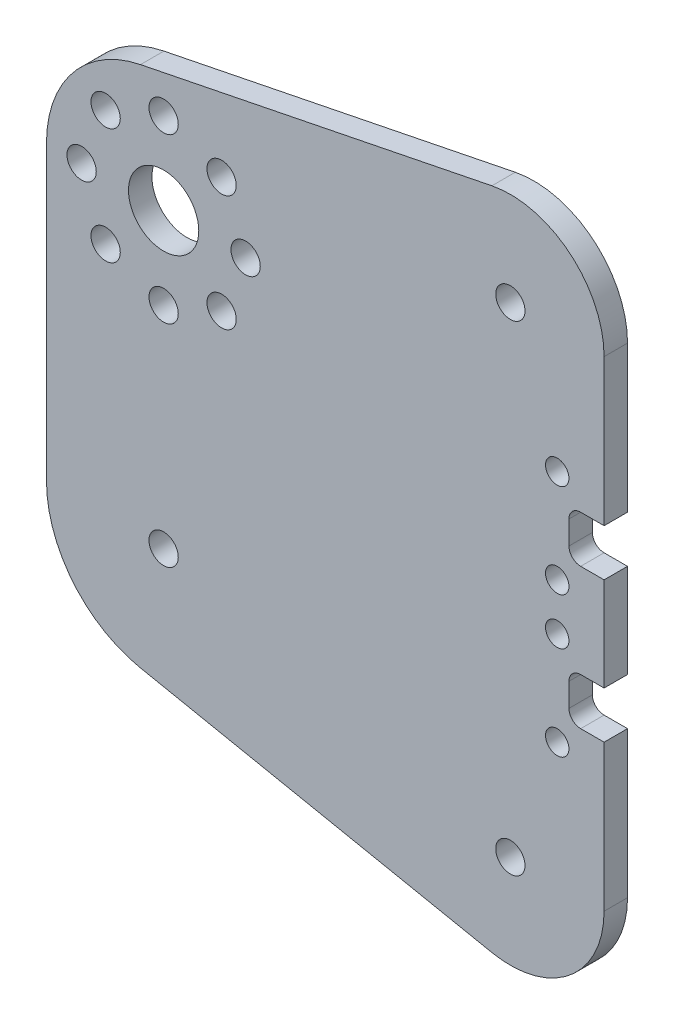
from build123d import *

# Parameters (mm, degrees)
SKETCH_1_R      = 3
SKETCH_1_R_2    = 1.25
SKETCH_1_R_3    = 1
EXTRUDE_2_DEPTH = 2


with BuildPart() as part:
    # 草圖1 → 填料-伸長2 (new body)
    with BuildSketch(Plane.XY):
        with BuildLine():
            Line((-28.541905067, -16.1179941), (-28.541905067, -41.1179941))
            ThreePointArc((-28.541905067, -41.1179941), (-26.279428563, -47.452876116), (-20.515759037, -50.921253788))
            Line((-20.515759037, -50.921253788), (9.479011757, -56.960601851))
            ThreePointArc((9.479011757, -56.960601851), (16.126000545, -55.308012897), (19.058094933, -49.1179941))
            Line((19.058094933, -49.1179941), (19.058094933, -36.6179941))
            Line((19.058094933, -36.6179941), (17.058094933, -36.6179941))
            ThreePointArc((17.058094933, -36.6179941), (16.350988152, -36.325100881), (16.058094933, -35.6179941))
            Line((16.058094933, -35.6179941), (16.058094933, -33.6179941))
            ThreePointArc((16.058094933, -33.6179941), (16.350988152, -32.910887319), (17.058094933, -32.6179941))
            Line((17.058094933, -32.6179941), (19.058094933, -32.6179941))
            Line((19.058094933, -32.6179941), (19.058094933, -24.6179941))
            Line((19.058094933, -24.6179941), (17.058094933, -24.6179941))
            ThreePointArc((17.058094933, -24.6179941), (16.350988152, -24.325100881), (16.058094933, -23.6179941))
            Line((16.058094933, -23.6179941), (16.058094933, -21.6179941))
            ThreePointArc((16.058094933, -21.6179941), (16.350988152, -20.910887319), (17.058094933, -20.6179941))
            Line((17.058094933, -20.6179941), (19.058094933, -20.6179941))
            Line((19.058094933, -20.6179941), (19.058094933, -8.1179941))
            ThreePointArc((19.058094933, -8.1179941), (16.126000545, -1.927975304), (9.479011757, -0.27538635))
            Line((9.479011757, -0.27538635), (-20.515759037, -6.314734412))
            ThreePointArc((-20.515759037, -6.314734412), (-26.279428563, -9.783112085), (-28.541905067, -16.1179941))
        make_face()
        with Locations((-18.541905067, -16.1179941)):
            Circle(SKETCH_1_R, mode=Mode.SUBTRACT)
        with Locations((-18.541905067, -9.1179941)):
            Circle(SKETCH_1_R_2, mode=Mode.SUBTRACT)
        with Locations((-13.592157599, -11.168246632)):
            Circle(SKETCH_1_R_2, mode=Mode.SUBTRACT)
        with Locations((-11.541905067, -16.1179941)):
            Circle(SKETCH_1_R_2, mode=Mode.SUBTRACT)
        with Locations((-13.592157599, -21.067741569)):
            Circle(SKETCH_1_R_2, mode=Mode.SUBTRACT)
        with Locations((-18.541905067, -23.1179941)):
            Circle(SKETCH_1_R_2, mode=Mode.SUBTRACT)
        with Locations((-23.491652536, -21.067741569)):
            Circle(SKETCH_1_R_2, mode=Mode.SUBTRACT)
        with Locations((-25.541905067, -16.1179941)):
            Circle(SKETCH_1_R_2, mode=Mode.SUBTRACT)
        with Locations((-23.491652536, -11.168246632)):
            Circle(SKETCH_1_R_2, mode=Mode.SUBTRACT)
        with Locations((-18.541905067, -41.1179941)):
            Circle(SKETCH_1_R_2, mode=Mode.SUBTRACT)
        with Locations((11.058094933, -8.1179941)):
            Circle(SKETCH_1_R_2, mode=Mode.SUBTRACT)
        with Locations((11.058094933, -49.1179941)):
            Circle(SKETCH_1_R_2, mode=Mode.SUBTRACT)
        with Locations((15.058094933, -26.6179941)):
            Circle(SKETCH_1_R_3, mode=Mode.SUBTRACT)
        with Locations((15.058094933, -18.6179941)):
            Circle(SKETCH_1_R_3, mode=Mode.SUBTRACT)
        with Locations((15.058094933, -38.6179941)):
            Circle(SKETCH_1_R_3, mode=Mode.SUBTRACT)
        with Locations((15.058094933, -30.6179941)):
            Circle(SKETCH_1_R_3, mode=Mode.SUBTRACT)
    extrude(amount=EXTRUDE_2_DEPTH)


solid = part.part
